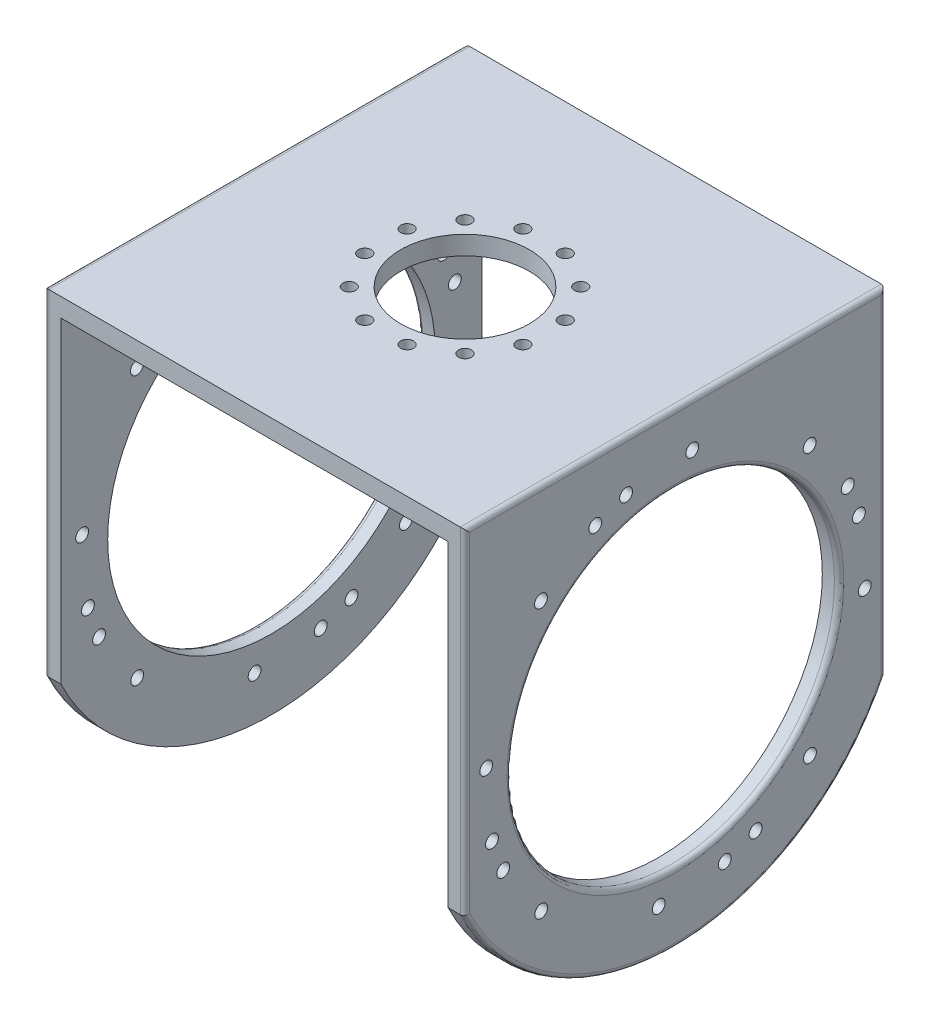
from build123d import *

# Parameters (mm, degrees)
EXTRUDE_1_DEPTH          = 180
SKETCH_2_R               = 27.5
CUT_EXTRUDE_1_DEPTH      = 180
SKETCH_3_R               = 70
CUT_EXTRUDE_2_DEPTH      = 217
CUT_EXTRUDE_5_DEPTH      = 324.728281125
CUT_EXTRUDE_5_DEPTH_BACK = 324.728281125
FILLET_2_R               = 2
CUT_EXTRUDE_6_DEPTH      = 324.728281298
CUT_EXTRUDE_6_DEPTH_BACK = 324.728281298
SKETCH_10_R              = 2.75
SKETCH_11_R              = 2.75
CUT_EXTRUDE_7_DEPTH      = 29


with BuildPart() as part:
    # 草图1 → 凸台-拉伸1 (new body)
    with BuildSketch(Plane.XY):
        Polygon((-90, 200), (90, 200), (90, 0), (82.8, 0), (82.8, 192), (-82.8, 192), (-82.8, 0), (-90, 0), align=None)
    extrude(amount=EXTRUDE_1_DEPTH)

    # 草图2 → 切除-拉伸1 (cut)
    with BuildSketch(Plane(origin=(0, 200, 0), x_dir=(1, 0, 0), z_dir=(0, 1, 0))):
        with Locations(Location((0, -90, 0), (0, 0, 270))):
            Circle(SKETCH_2_R)
    extrude(amount=-CUT_EXTRUDE_1_DEPTH, mode=Mode.SUBTRACT)

    # 草图3 → 切除-拉伸2 (cut)
    with BuildSketch(Plane(origin=(90, 0, 0), x_dir=(0, 0, -1), z_dir=(1, 0, 0))):
        with Locations(Location((-90, 100, 0), (0, 0, 90))):
            Circle(SKETCH_3_R)
    extrude(amount=-CUT_EXTRUDE_2_DEPTH, mode=Mode.SUBTRACT)

    # 草图9 → 切除-拉伸5 (cut, two sides: drawn at the far end of the back side and taken through both)
    with BuildSketch(Plane(origin=(90, 0, 0), x_dir=(0, 0, -1), z_dir=(1, 0, 0)).offset(-CUT_EXTRUDE_5_DEPTH_BACK)):
        with BuildLine():
            Line((0, 0), (0, 56.411010565))
            ThreePointArc((0, 56.411010565), (-36.891144692, 15.268367844), (-90.000000357, 0))
            Line((-90.000000357, 0), (0, 0))
        make_face()
        with BuildLine():
            Line((-180, 0), (-90.000000357, 0))
            ThreePointArc((-90.000000357, 0), (-143.108855611, 15.268368034), (-180, 56.411010565))
            Line((-180, 56.411010565), (-180, 0))
        make_face()
    extrude(amount=CUT_EXTRUDE_5_DEPTH + CUT_EXTRUDE_5_DEPTH_BACK, mode=Mode.SUBTRACT)

    # 圆角2
    fillet_2_edges = [part.edges().sort_by_distance(p)[0] for p in [
        (-90, 128.205505282, 0),
        (-90, 128.205505282, 180),
        (-90, 200, 90),
        (90, 200, 90),
        (-90, 30, 90),
        (90, 30, 90),
        (90, 128.205505282, 0),
        (90, 0, 90),
        (-90, 0, 90),
        (90, 128.205505282, 180),
    ]]
    fillet(fillet_2_edges, radius=FILLET_2_R)

    # 草图10 → 切除-拉伸6 (cut, two sides: drawn at the far end of the back side and taken through both)
    with BuildSketch(Plane(origin=(90, 0, 0), x_dir=(0, 0, -1), z_dir=(1, 0, 0)).offset(-CUT_EXTRUDE_6_DEPTH_BACK)):
        with Locations(Location((-32.609998318, 157.514782508, 0), (0, 0, 90))):
            Circle(SKETCH_10_R)
        with Locations(Location((-16.325246691, 134.257746931, 0), (0, 0, 90))):
            Circle(SKETCH_10_R)
        with Locations(Location((-11.541409366, 121.114261903, 0), (0, 0, 90))):
            Circle(SKETCH_10_R)
        with Locations(Location((-9.066918551, 92.830702464, 0), (0, 0, 90))):
            Circle(SKETCH_10_R)
        with Locations(Location((-32.485217492, 42.609998318, 0), (0, 0, 90))):
            Circle(SKETCH_10_R)
        with Locations(Location((-55.742253069, 26.325246691, 0), (0, 0, 90))):
            Circle(SKETCH_10_R)
        with Locations(Location((-68.885738097, 21.541409366, 0), (0, 0, 90))):
            Circle(SKETCH_10_R)
        with Locations(Location((-97.169297536, 19.066918551, 0), (0, 0, 90))):
            Circle(SKETCH_10_R)
        with Locations(Location((-147.390001682, 42.485217492, 0), (0, 0, 90))):
            Circle(SKETCH_10_R)
        with Locations(Location((-163.674753309, 65.742253069, 0), (0, 0, 90))):
            Circle(SKETCH_10_R)
        with Locations(Location((-168.458590634, 78.885738097, 0), (0, 0, 90))):
            Circle(SKETCH_10_R)
        with Locations(Location((-170.933081449, 107.169297536, 0), (0, 0, 90))):
            Circle(SKETCH_10_R)
        with Locations(Location((-147.514782508, 157.390001682, 0), (0, 0, 90))):
            Circle(SKETCH_10_R)
        with Locations(Location((-124.257746931, 173.674753309, 0), (0, 0, 90))):
            Circle(SKETCH_10_R)
        with Locations(Location((-111.114261903, 178.458590634, 0), (0, 0, 90))):
            Circle(SKETCH_10_R)
        with Locations(Location((-82.830702464, 180.933081449, 0), (0, 0, 90))):
            Circle(SKETCH_10_R)
    extrude(amount=CUT_EXTRUDE_6_DEPTH + CUT_EXTRUDE_6_DEPTH_BACK, mode=Mode.SUBTRACT)

    # 草图11 → 切除-拉伸7 (cut)
    with BuildSketch(Plane.XZ.offset(-192)):
        with Locations(Location((9.058666579, 123.80740392, 0), (0, 0, 270))):
            Circle(SKETCH_11_R)
        with Locations(Location((24.748737342, 114.748737342, 0), (0, 0, 270))):
            Circle(SKETCH_11_R)
        with Locations(Location((33.80740392, 99.058666579, 0), (0, 0, 270))):
            Circle(SKETCH_11_R)
        with Locations(Location((33.80740392, 80.941333421, 0), (0, 0, 270))):
            Circle(SKETCH_11_R)
        with Locations(Location((24.748737342, 65.251262658, 0), (0, 0, 270))):
            Circle(SKETCH_11_R)
        with Locations(Location((9.058666579, 56.19259608, 0), (0, 0, 270))):
            Circle(SKETCH_11_R)
        with Locations(Location((-9.058666579, 56.19259608, 0), (0, 0, 270))):
            Circle(SKETCH_11_R)
        with Locations(Location((-24.748737342, 65.251262658, 0), (0, 0, 270))):
            Circle(SKETCH_11_R)
        with Locations(Location((-33.80740392, 80.941333421, 0), (0, 0, 270))):
            Circle(SKETCH_11_R)
        with Locations(Location((-33.80740392, 99.058666579, 0), (0, 0, 270))):
            Circle(SKETCH_11_R)
        with Locations(Location((-24.748737342, 114.748737342, 0), (0, 0, 270))):
            Circle(SKETCH_11_R)
        with Locations(Location((-9.058666579, 123.80740392, 0), (0, 0, 270))):
            Circle(SKETCH_11_R)
    extrude(amount=-CUT_EXTRUDE_7_DEPTH, mode=Mode.SUBTRACT)


solid = part.part
